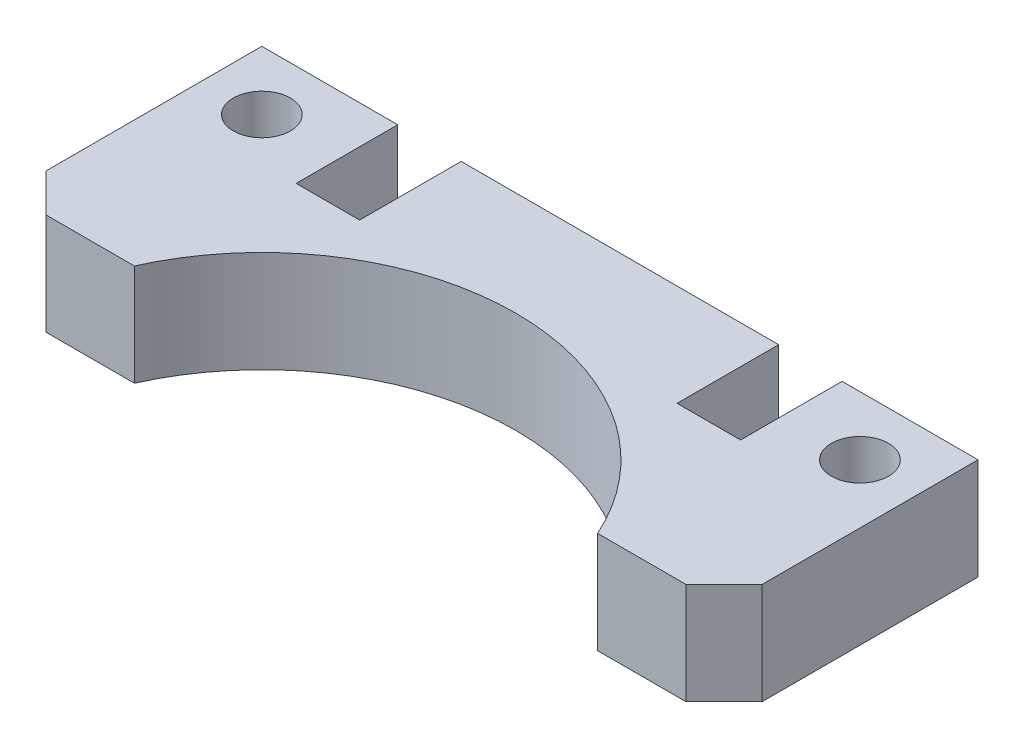
from build123d import *

# Parameters (mm, degrees)
SKETCH_1_W          = 56.4
SKETCH_1_H          = 20
EXTRUDE_1_DEPTH     = 8
SKETCH_2_R          = 2.25
CUT_EXTRUDE_1_DEPTH = 8
CHAMFER_1_SIZE      = 3
SKETCH_3_R          = 20
CUT_EXTRUDE_2_DEPTH = 8
SKETCH_4_W          = 5
SKETCH_4_H          = 8
CUT_EXTRUDE_3_DEPTH = 8


with BuildPart() as part:
    # 스케치1 → 보스-돌출1 (new body)
    with BuildSketch(Plane(origin=(0, 0, 0), x_dir=(1, 0, 0), z_dir=(0, 1, 0))):
        with Locations((28.2, 10)):
            Rectangle(SKETCH_1_W, SKETCH_1_H)
    extrude(amount=EXTRUDE_1_DEPTH)

    # 스케치2 → 컷-돌출1 (cut)
    with BuildSketch(Plane(origin=(0, 8, 0), x_dir=(1, 0, 0), z_dir=(0, 1, 0))):
        with Locations(Location((51.75, 15.35, 0), (0, 0, 270))):
            Circle(SKETCH_2_R)
        with Locations(Location((4.65, 15.35, 0), (0, 0, 270))):
            Circle(SKETCH_2_R)
    extrude(amount=-CUT_EXTRUDE_1_DEPTH, mode=Mode.SUBTRACT)

    # 모따기1
    chamfer_1_edges = [part.edges().sort_by_distance(p)[0] for p in [
        (56.4, 4, 0),
        (0, 4, 0),
    ]]
    chamfer(chamfer_1_edges, length=CHAMFER_1_SIZE)

    # 스케치3 → 컷-돌출2 (cut)
    with BuildSketch(Plane(origin=(0, 8, 0), x_dir=(1, 0, 0), z_dir=(0, 1, 0))):
        with Locations((28.2, -8.2)):
            Circle(SKETCH_3_R)
    extrude(amount=-CUT_EXTRUDE_2_DEPTH, mode=Mode.SUBTRACT)

    # 스케치4 → 컷-돌출3 (cut)
    with BuildSketch(Plane(origin=(0, 8, 0), x_dir=(1, 0, 0), z_dir=(0, 1, 0))):
        with Locations((13.2, 16)):
            Rectangle(SKETCH_4_W, SKETCH_4_H)
        with Locations((43.2, 16)):
            Rectangle(SKETCH_4_W, SKETCH_4_H)
    extrude(amount=-CUT_EXTRUDE_3_DEPTH, mode=Mode.SUBTRACT)


solid = part.part
